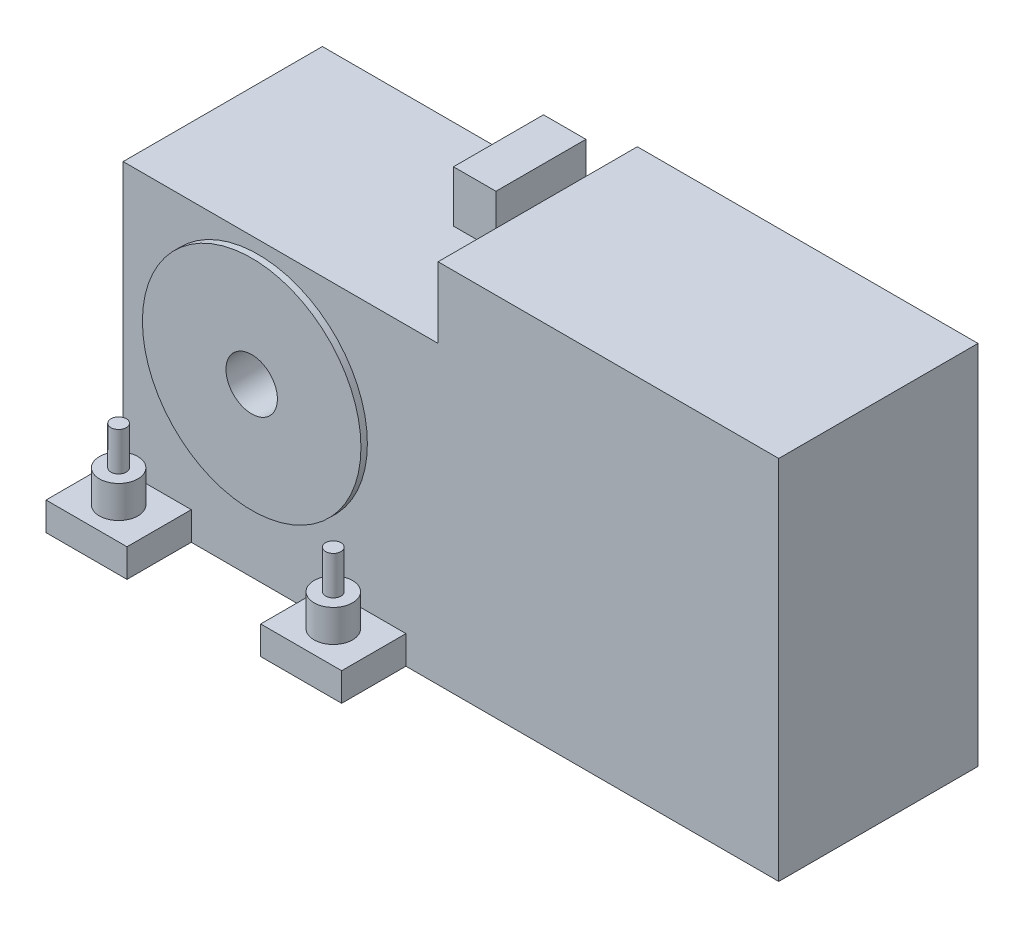
from build123d import *
from build123d.topology import SkipClean

# Parameters (mm, degrees)
SKETCH2_R           = 85
SKETCH2_R_2         = 20
BOSS_EXTRUDE1_DEPTH = 5
BOSS_EXTRUDE2_START = 155
SKETCH3_R           = 20
BOSS_EXTRUDE2_DEPTH = 155
SKETCH4_W           = 33
SKETCH4_H           = 40
BOSS_EXTRUDE4_DEPTH = 70
SKETCH6_W           = 63
SKETCH6_H           = 50
SKETCH6_R           = 15
BOSS_EXTRUDE6_DEPTH = 22
SKETCH6_3_R         = 15
SKETCH6_3_R_2       = 6
BOSS_EXTRUDE7_DEPTH = 47
SKETCH6_4_R         = 6
BOSS_EXTRUDE8_DEPTH = 77


with BuildPart() as part:
    # Sketch2 → Boss-Extrude1 (new body)
    with BuildSketch(Plane.XY):
        Circle(SKETCH2_R)
        Circle(SKETCH2_R_2, mode=Mode.SUBTRACT)
    extrude(amount=BOSS_EXTRUDE1_DEPTH)

    # Sketch3 → Boss-Extrude2 (add)
    with SkipClean():  # the faces are left unmerged after this step: merging them gives an invalid solid
        with BuildSketch(Plane(origin=(0, 0, 0), x_dir=(-1, 0, 0), z_dir=(0, 0, -1)).offset(BOSS_EXTRUDE2_START)):
            Polygon((-140, 150), (-405, 150), (-405, -135), (105, -135), (105, 95), (-140, 95), align=None)
            Circle(SKETCH3_R, mode=Mode.SUBTRACT)
        extrude(amount=-BOSS_EXTRUDE2_DEPTH)

    # Sketch4 → Boss-Extrude4 (add)
    with SkipClean():  # the faces are left unmerged after this step: merging them gives an invalid solid
        with BuildSketch(Plane(origin=(0, 0, -155), x_dir=(-1, 0, 0), z_dir=(0, 0, -1))):
            with Locations((-83.5, 115)):
                Rectangle(SKETCH4_W, SKETCH4_H)
        extrude(amount=-BOSS_EXTRUDE4_DEPTH)

    # Sketch6 → Boss-Extrude6 (add)
    # profile 1 of 2: a face of its own
    with SkipClean():  # the faces are left unmerged after this step: merging them gives an invalid solid
        with BuildSketch(Plane.XZ.offset(135)):
            with Locations((-83.5, 25)):
                Rectangle(SKETCH6_W, SKETCH6_H)
            with Locations((-83.5, 25)):
                Circle(SKETCH6_R, mode=Mode.SUBTRACT)
        # profile 2 of 2: a face of its own
        with BuildSketch(Plane.XZ.offset(135)):
            with Locations((83.5, 25)):
                Rectangle(SKETCH6_W, SKETCH6_H)
            with Locations((83.5, 25)):
                Circle(SKETCH6_R, mode=Mode.SUBTRACT)
        extrude(amount=-BOSS_EXTRUDE6_DEPTH)

    # Sketch6<3> → Boss-Extrude7 (add)
    # profile 1 of 2: a face of its own
    with SkipClean():  # the faces are left unmerged after this step: merging them gives an invalid solid
        with BuildSketch(Plane.XZ.offset(135)):
            with Locations((-83.5, 25)):
                Circle(SKETCH6_3_R)
            with Locations((-83.5, 25)):
                Circle(SKETCH6_3_R_2, mode=Mode.SUBTRACT)
        # profile 2 of 2: a face of its own
        with BuildSketch(Plane.XZ.offset(135)):
            with Locations((83.5, 25)):
                Circle(SKETCH6_3_R)
            with Locations((83.5, 25)):
                Circle(SKETCH6_3_R_2, mode=Mode.SUBTRACT)
        extrude(amount=-BOSS_EXTRUDE7_DEPTH)

    # Sketch6<4> → Boss-Extrude8 (add)
    with SkipClean():  # the faces are left unmerged after this step: merging them gives an invalid solid
        with BuildSketch(Plane.XZ.offset(135)):
            with Locations((-83.5, 25)):
                Circle(SKETCH6_4_R)
            with Locations((83.5, 25)):
                Circle(SKETCH6_4_R)
        extrude(amount=-BOSS_EXTRUDE8_DEPTH)


solid = part.part
